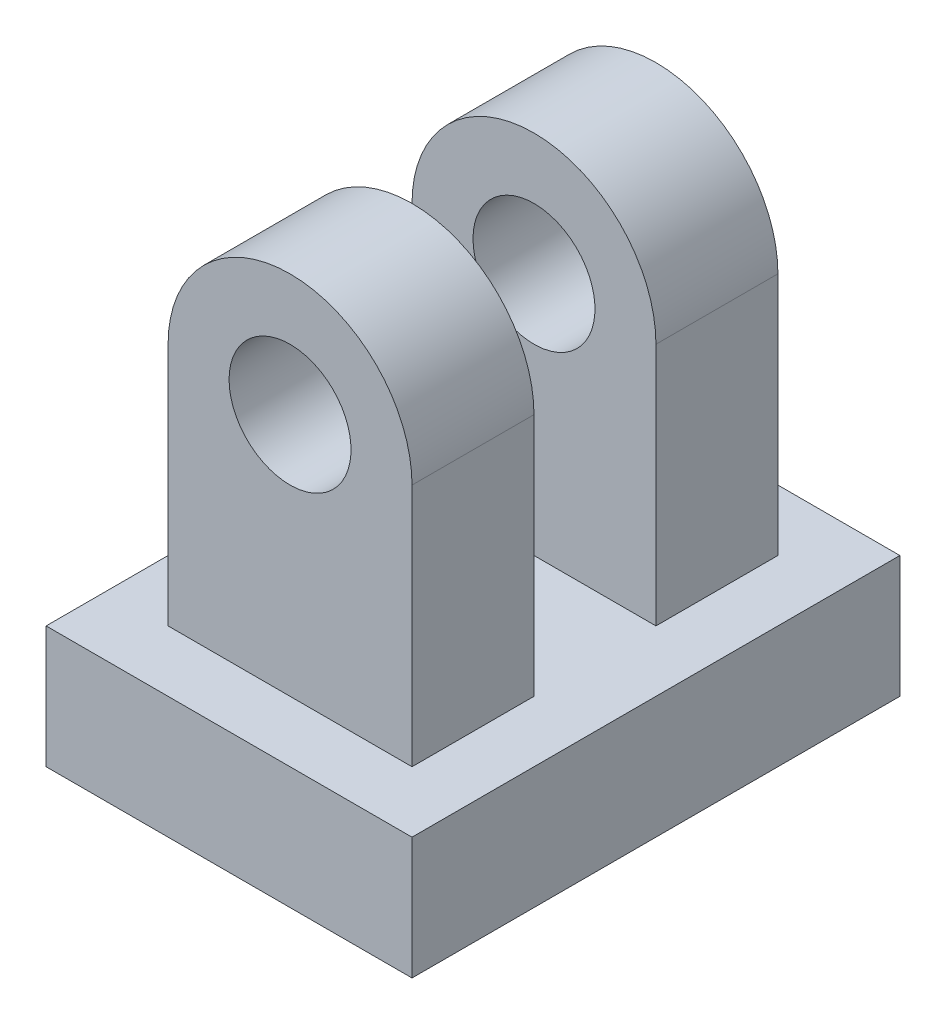
from build123d import *

# Parameters (mm, degrees)
SKETCH1_W           = 3
SKETCH1_H           = 4
BOSS_EXTRUDE1_DEPTH = 1
SKETCH1_3_W         = 2
SKETCH1_3_H         = 1
BOSS_EXTRUDE2_DEPTH = 3
SKETCH2_R           = 0.5
CUT_EXTRUDE1_DEPTH  = 3


with BuildPart() as part:
    # Sketch1 → Boss-Extrude1 (new body)
    with BuildSketch(Plane(origin=(0, 0, 0), x_dir=(1, 0, 0), z_dir=(0, 1, 0))):
        Rectangle(SKETCH1_W, SKETCH1_H)
    extrude(amount=-BOSS_EXTRUDE1_DEPTH)

    # Sketch1<3> → Boss-Extrude2 (add)
    with BuildSketch(Plane(origin=(0, 0, 0), x_dir=(1, 0, 0), z_dir=(0, 1, 0))):
        with Locations((0, 1)):
            Rectangle(SKETCH1_3_W, SKETCH1_3_H)
        with Locations((0, -1)):
            Rectangle(SKETCH1_3_W, SKETCH1_3_H)
    extrude(amount=BOSS_EXTRUDE2_DEPTH)

    # Sketch2 → Cut-Extrude1 (cut)
    with BuildSketch(Plane(origin=(0, 0, -1.5), x_dir=(-1, 0, 0), z_dir=(0, 0, -1))):
        with BuildLine():
            Line((-1, 3), (-1, 2))
            ThreePointArc((-1, 2), (-0.707106781, 2.707106781), (0, 3))
            Line((0, 3), (-1, 3))
        make_face()
        with BuildLine():
            ThreePointArc((0, 3), (0.707106781, 2.707106781), (1, 2))
            Line((1, 2), (1, 3))
            Line((1, 3), (0, 3))
        make_face()
        with Locations((0, 2)):
            Circle(SKETCH2_R)
    extrude(amount=-CUT_EXTRUDE1_DEPTH, mode=Mode.SUBTRACT)


solid = part.part
